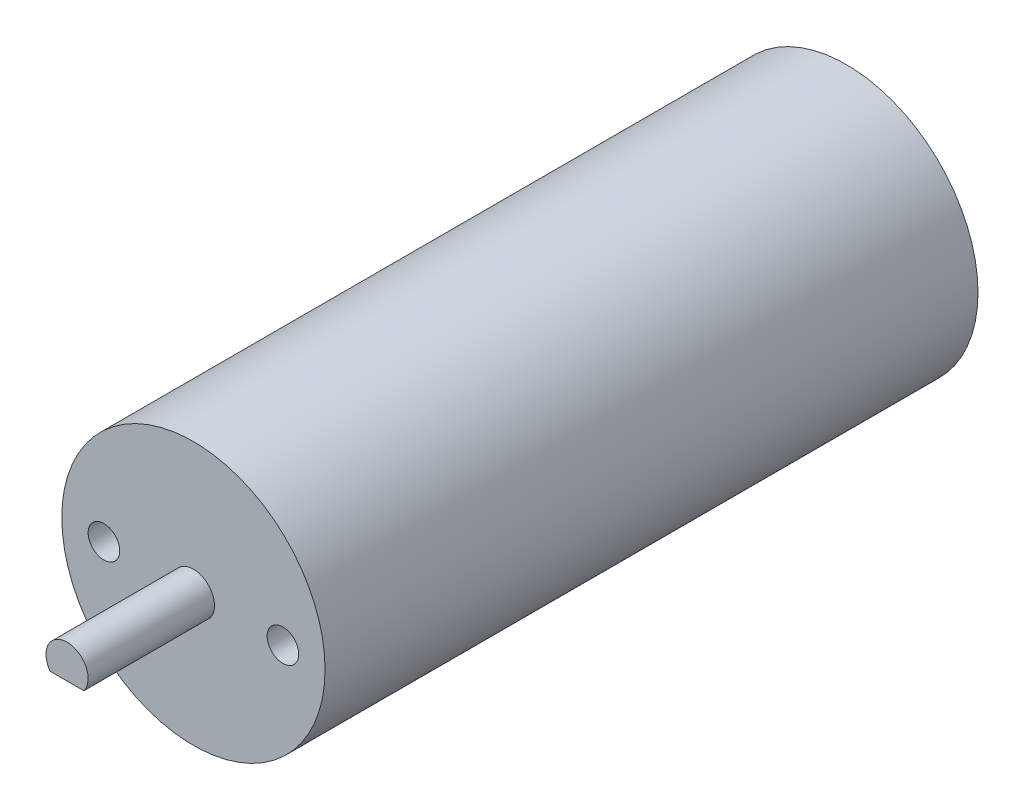
from build123d import *

# Parameters (mm, degrees)
SKICA1_R                 = 12.5
P_IDAT_VYSUNUT_M1_DEPTH  = 62
P_IDAT_VYSUNUT_M2_DEPTH  = 12
SKICA3_R                 = 1.5
ODEBRAT_VYSUNUT_M1_DEPTH = 4


with BuildPart() as part:
    # Skica1 → Přidat vysunutím1 (new body)
    with BuildSketch(Plane.XY):
        Circle(SKICA1_R)
    extrude(amount=P_IDAT_VYSUNUT_M1_DEPTH)

    # Skica2 → Přidat vysunutím2 (add)
    with BuildSketch(Plane.XY.offset(62)):
        with BuildLine():
            Line((-1.6, -1.2), (1.6, -1.2))
            ThreePointArc((1.6, -1.2), (0, 2), (-1.6, -1.2))
        make_face()
    extrude(amount=P_IDAT_VYSUNUT_M2_DEPTH)

    # Skica3 → Odebrat vysunutím1 (cut)
    with BuildSketch(Plane.XY.offset(62)):
        with Locations((-8.5, 0)):
            Circle(SKICA3_R)
        with Locations(Location((8.5, 0, 0), (0, 0, 180))):
            Circle(SKICA3_R)
    extrude(amount=-ODEBRAT_VYSUNUT_M1_DEPTH, mode=Mode.SUBTRACT)


solid = part.part
